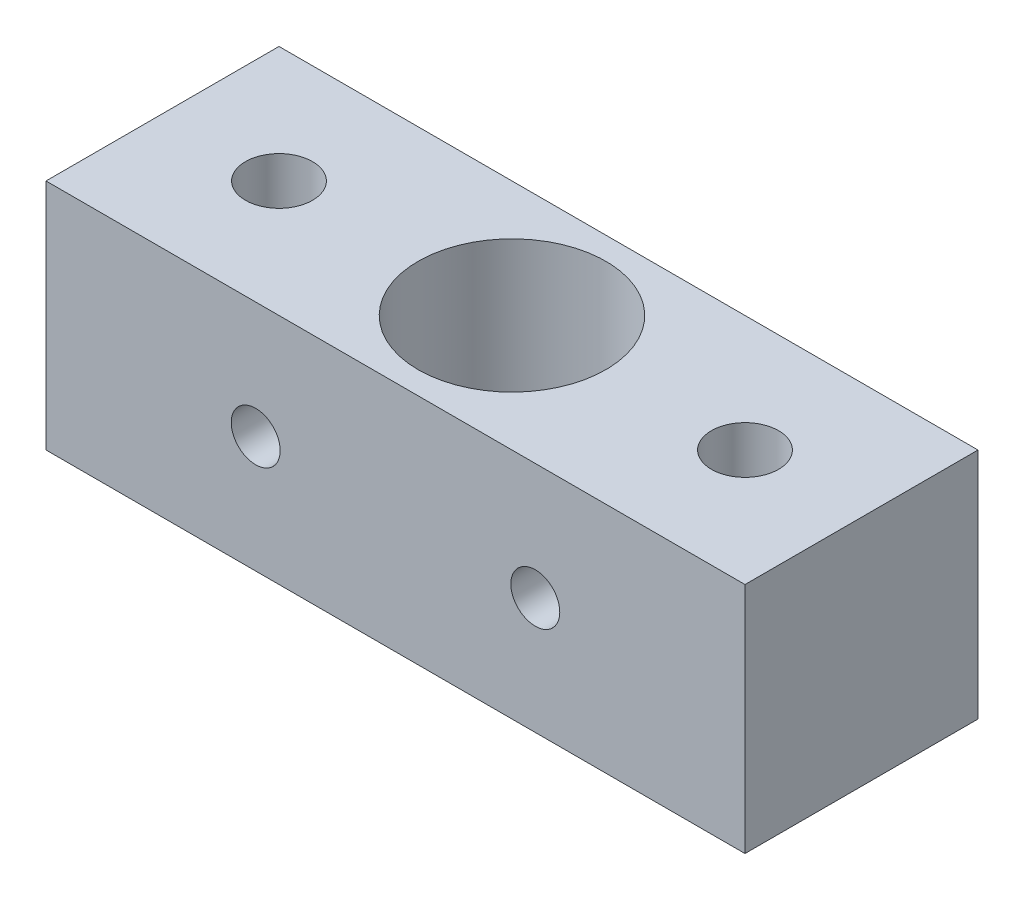
from build123d import *

# Parameters (mm, degrees)
SKETCH1_W           = 38.1
SKETCH1_H           = 12.7
BOSS_EXTRUDE1_DEPTH = 12.7
SKETCH2_R           = 5.1181
SKETCH2_R_2         = 1.8288
CUT_EXTRUDE1_DEPTH  = 12.7
SKETCH3_R           = 1.3335
CUT_EXTRUDE2_DEPTH  = 12.7


with BuildPart() as part:
    # Sketch1 → Boss-Extrude1 (new body)
    with BuildSketch(Plane(origin=(0, 0, 0), x_dir=(1, 0, 0), z_dir=(0, 1, 0))):
        Rectangle(SKETCH1_W, SKETCH1_H)
    extrude(amount=BOSS_EXTRUDE1_DEPTH)

    # Sketch2 → Cut-Extrude1 (cut)
    with BuildSketch(Plane(origin=(0, 12.7, 0), x_dir=(1, 0, 0), z_dir=(0, 1, 0))):
        with Locations(Location((0, 0, 0), (0, 0, 270))):
            Circle(SKETCH2_R)
        with Locations(Location((-12.7, 0, 0), (0, 0, 270))):
            Circle(SKETCH2_R_2)
        with Locations(Location((12.7, 0, 0), (0, 0, 270))):
            Circle(SKETCH2_R_2)
    extrude(amount=-CUT_EXTRUDE1_DEPTH, mode=Mode.SUBTRACT)

    # Sketch3 → Cut-Extrude2 (cut)
    with BuildSketch(Plane.XY.offset(6.35)):
        with Locations((-7.62, 6.35)):
            Circle(SKETCH3_R)
        with Locations((7.62, 6.35)):
            Circle(SKETCH3_R)
    extrude(amount=-CUT_EXTRUDE2_DEPTH, mode=Mode.SUBTRACT)


solid = part.part
